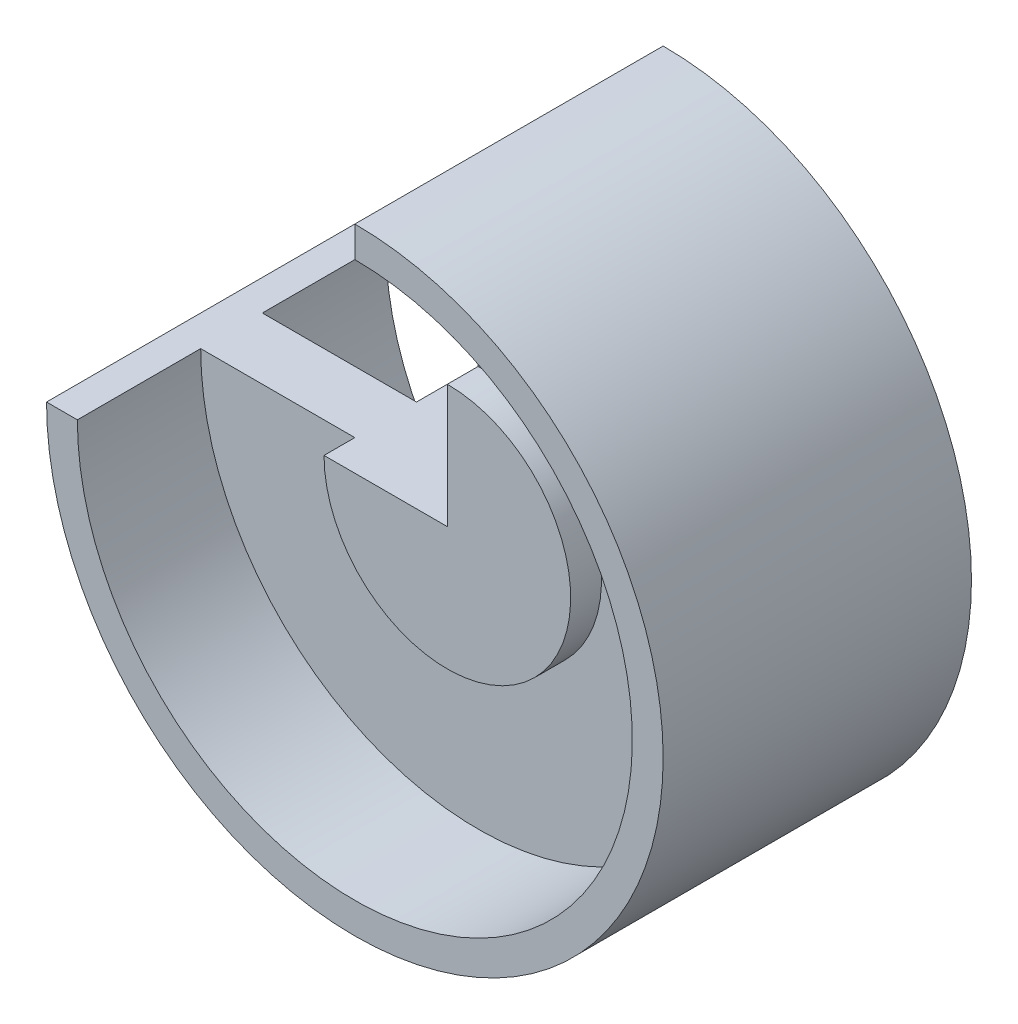
from build123d import *

# Parameters (mm, degrees)
REVOLVE16_ANGLE = 270


with BuildPart() as part:
    # Sketch1 → Revolve16 (revolve)
    with BuildSketch(Plane(origin=(0, 0, 0), x_dir=(0, 0, -1), z_dir=(1, 0, 0))):
        Polygon((-25, 50), (25, 50), (25, 45), (5, 45), (5, 20), (10, 20), (10, 0), (-10, 0), (-10, 20), (-5, 20), (-5, 45), (-25, 45), align=None)
    revolve(axis=Axis((0, 0, 0), (0, 0, -1)), revolution_arc=REVOLVE16_ANGLE)


solid = part.part
